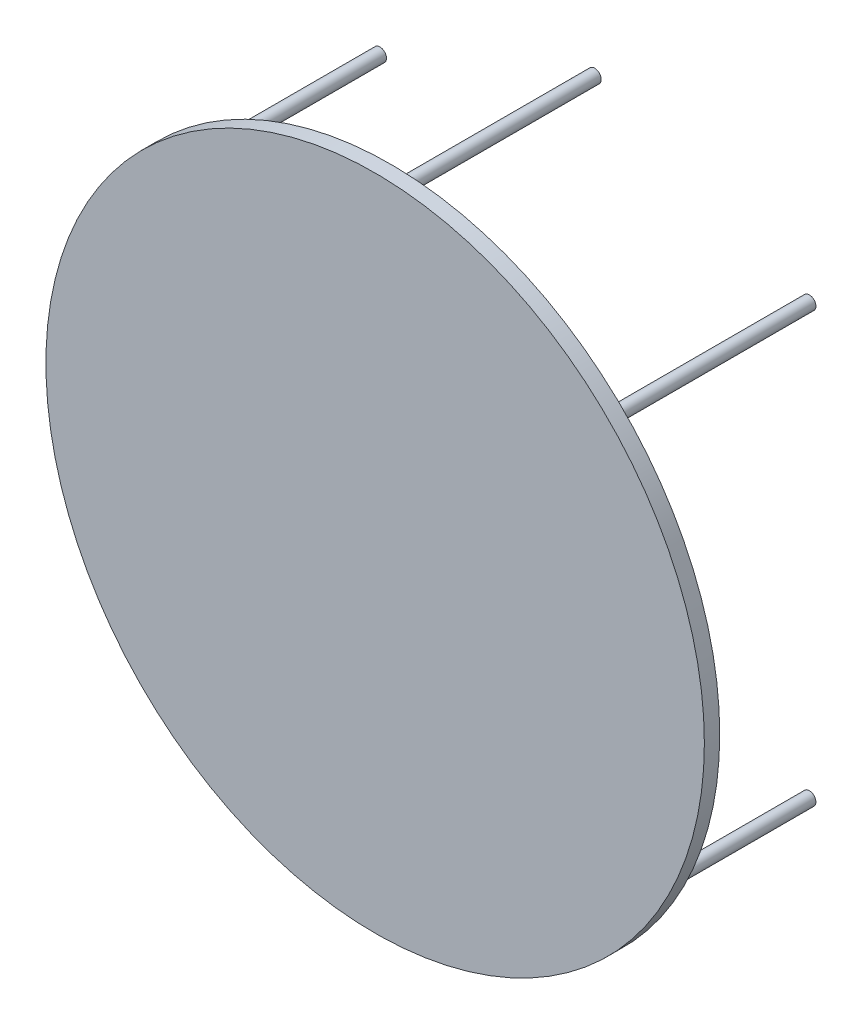
from build123d import *

# Parameters (mm, degrees)
SKETCH1_R      = 114.3
PLATFORM_DEPTH = 5.334
SKETCH3_R      = 2.286
PEGS_DEPTH     = 70.866


with BuildPart() as part:
    # Sketch1 → Platform (new body)
    with BuildSketch(Plane.XY):
        Circle(SKETCH1_R)
    extrude(amount=PLATFORM_DEPTH)

    # Sketch3 → Pegs (add)
    with BuildSketch(Plane(origin=(0, 0, 0), x_dir=(-1, 0, 0), z_dir=(0, 0, -1))):
        with Locations(Location((0, 105.41, 0), (0, 0, 180))):
            Circle(SKETCH3_R)
        with Locations(Location((-74.536125805, 74.536125805, 0), (0, 0, 180))):
            Circle(SKETCH3_R)
        with Locations(Location((-74.536125805, -74.536125805, 0), (0, 0, 180))):
            Circle(SKETCH3_R)
        with Locations(Location((0, -105.41, 0), (0, 0, 180))):
            Circle(SKETCH3_R)
        with Locations(Location((74.536125805, -74.536125805, 0), (0, 0, 180))):
            Circle(SKETCH3_R)
        with Locations(Location((74.536125805, 74.536125805, 0), (0, 0, 180))):
            Circle(SKETCH3_R)
    extrude(amount=PEGS_DEPTH)


solid = part.part
